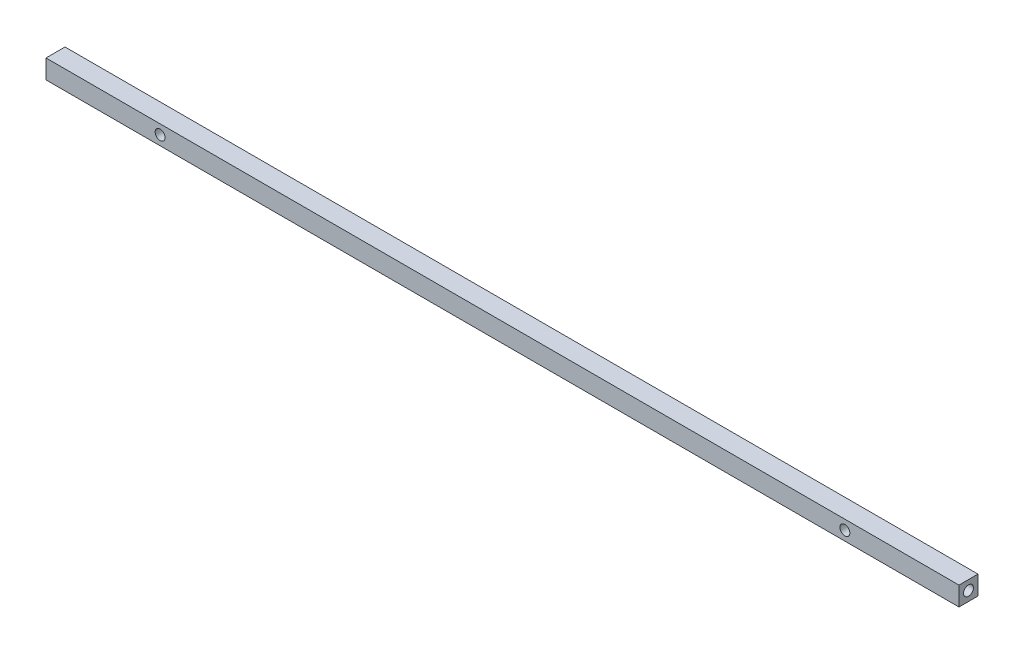
from build123d import *

# Parameters (mm, degrees)
SKETCH1_W           = 6.35
SKETCH1_H           = 6.35
BOSS_EXTRUDE1_DEPTH = 152.4
SKETCH4_R           = 1.651
CUT_EXTRUDE1_DEPTH  = 12.7
SKETCH5_R           = 1.651
CUT_EXTRUDE2_DEPTH  = 153.565274965


with BuildPart() as part:
    # Sketch1 → Boss-Extrude1 (new, symmetric)
    with BuildSketch(Plane(origin=(0, 0, 0), x_dir=(0, 0, -1), z_dir=(1, 0, 0))):
        Rectangle(SKETCH1_W, SKETCH1_H)
    extrude(amount=BOSS_EXTRUDE1_DEPTH, both=True)

    # Sketch4 → Cut-Extrude1 (cut)
    with BuildSketch(Plane(origin=(152.4, 0, 0), x_dir=(0, 0, -1), z_dir=(1, 0, 0))):
        Circle(SKETCH4_R)
    cut_extrude1 = extrude(amount=-CUT_EXTRUDE1_DEPTH, mode=Mode.SUBTRACT)

    # Sketch5 → Cut-Extrude2 (cut, through all)
    with BuildSketch(Plane.XY.offset(3.175)):
        with Locations((114.3, 0)):
            Circle(SKETCH5_R)
    cut_extrude2 = extrude(amount=-CUT_EXTRUDE2_DEPTH, mode=Mode.SUBTRACT)

    # Mirror1: Cut-Extrude1, Cut-Extrude2 across plane
    add(cut_extrude1.mirror(Plane(origin=(0, 0, 0), x_dir=(0, 0, 1), z_dir=(1, 0, 0))), mode=Mode.SUBTRACT)
    add(cut_extrude2.mirror(Plane(origin=(0, 0, 0), x_dir=(0, 0, 1), z_dir=(1, 0, 0))), mode=Mode.SUBTRACT)


solid = part.part
